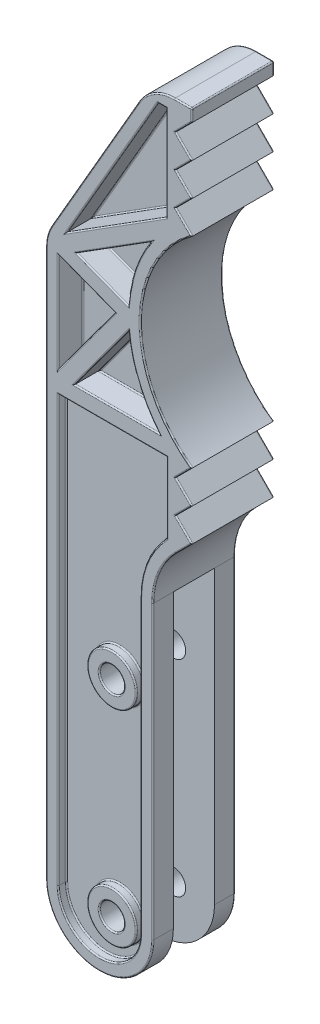
from build123d import *

# Parameters (mm, degrees)
SKETCH_1_R          = 1.5000000000000004
SKETCH_1_R_2        = 1.5000000000000009
EXTRUDE_1_DEPTH     = 5
CUT_EXTRUDE_1_DEPTH = 2.5
CUT_EXTRUDE_2_DEPTH = 1
SKETCH_4_R          = 3.000000000000001
SKETCH_4_R_2        = 1.5000000000000009
SKETCH_4_R_3        = 1.5000000000000007
EXTRUDE_2_DEPTH     = 1
CUT_EXTRUDE_3_DEPTH = 2
EXTRUDE_3_REACH     = 94.277
EXTRUDE_2_2_REACH   = 94.277
EXTRUDE_3_2_DEPTH   = 1
FILLET_8_R          = 5
FILLET_9_R          = 0.15


with BuildPart() as part:
    # 草图1 → 凸台-拉伸1 (new, symmetric)
    with BuildSketch(Plane.XY):
        with BuildLine():
            Line((0, 88.5), (-2, 86.50000000000001))
            Line((-2, 86.50000000000001), (0, 84.5))
            Line((0, 84.5), (-2, 82.5))
            Line((-2, 82.5), (0, 80.5))
            Line((0, 80.5), (-2.0000000000008176, 78.49999999999999))
            Line((-2.0000000000008176, 78.49999999999999), (-7.9661e-13, 76.50000000000001))
            ThreePointArc((-7.9661e-13, 76.50000000000001), (-6.27303030829221, 64.29999999999991), (-5.4253e-13, 52.1))
            Line((-5.4253e-13, 52.1), (-2.000000000000522, 50.099999999999994))
            Line((-2.000000000000522, 50.099999999999994), (0, 48.1))
            Line((0, 48.1), (-1.9999999999999958, 46.09999999999999))
            Line((-1.9999999999999958, 46.09999999999999), (0, 44.1))
            Line((0, 44.1), (-2, 42.1))
            ThreePointArc((-2, 42.1), (-4.035298285696091, 39.05396085688401), (-4.749999999999991, 35.46091270347397))
            Line((-4.749999999999991, 35.46091270347397), (-4.749999999999991, 0))
            ThreePointArc((-4.749999999999991, 0), (-11.249999999999993, -6.499999999999998), (-17.74999999999999, 0))
            Line((-17.74999999999999, 0), (-17.75, 67.91635220349652))
            Line((-17.75, 67.91635220349652), (-5, 90))
            Line((-5, 90), (0, 90))
            Line((0, 90), (0, 88.5))
        make_face()
        with Locations((-9.749999999999991, 0)):
            Circle(SKETCH_1_R, mode=Mode.SUBTRACT)
        with Locations((-9.749999999999991, 25)):
            Circle(SKETCH_1_R_2, mode=Mode.SUBTRACT)
    extrude(amount=EXTRUDE_1_DEPTH, both=True)

    # 草图2 → 切除-拉伸1 (cut, symmetric)
    with BuildSketch(Plane.XY):
        with BuildLine():
            Line((-14.999999999999993, -8.410797367109796), (-14.999999999999993, 23.589202632890206))
            ThreePointArc((-14.999999999999993, 23.589202632890206), (-12.08295106229247, 31.431396203569264), (-4.749999999999999, 35.46091270347397))
            Line((-4.749999999999999, 35.46091270347397), (-4.74999999999999, -8.410797367109796))
            Line((-4.74999999999999, -8.410797367109796), (-14.999999999999993, -8.410797367109796))
        make_face()
    cut_extrude_1 = extrude(amount=CUT_EXTRUDE_1_DEPTH, both=True, mode=Mode.SUBTRACT)

    # 草图3 → 切除-拉伸2 (cut)
    with BuildSketch(Plane.XY.offset(5)):
        with BuildLine():
            Line((-3.1276474698876005, 88.5), (-4.133974596215559, 88.5))
            Line((-4.133974596215559, 88.5), (-16.249999999999996, 67.51442841484983))
            Line((-16.249999999999996, 67.51442841484983), (-16.249999999999986, 0))
            ThreePointArc((-16.249999999999986, 0), (-11.24999999999999, -4.999999999999995), (-6.249999999999993, 7.2e-16))
            Line((-6.249999999999992, 6.1e-16), (-6.249999999999999, 35.46091270347397))
            ThreePointArc((-6.250000000000002, 35.46091270347397), (-5.4211175844630315, 39.62798600543165), (-3.0606601717798148, 43.16066017177982))
            Line((-3.0606601717798156, 43.16066017177982), (-3.0748559707931324, 52.76887208327246))
            ThreePointArc((-3.0748559707931413, 52.768872083272456), (-7.773012299367757, 64.27562185032697), (-3.1088780531322087, 75.79620407617077))
            Line((-3.108878053132212, 75.79620407617077), (-3.1276474698876005, 88.5))
        make_face()
    cut_extrude_2 = extrude(amount=-CUT_EXTRUDE_2_DEPTH, mode=Mode.SUBTRACT)

    # 草图4 → Extrude 2 (add)
    # profile 1 of 2: a face of its own
    with BuildSketch(Plane.XY.offset(4)):
        with Locations((-9.749999999999991, 25)):
            Circle(SKETCH_4_R)
        with Locations((-9.749999999999991, 25)):
            Circle(SKETCH_4_R_2, mode=Mode.SUBTRACT)
    # profile 2 of 2: a face of its own
    with BuildSketch(Plane.XY.offset(4)):
        with Locations((-9.749999999999991, 0)):
            Circle(SKETCH_4_R)
        with Locations((-9.749999999999991, 0)):
            Circle(SKETCH_4_R_3, mode=Mode.SUBTRACT)
    extrude_2 = extrude(amount=EXTRUDE_2_DEPTH)

    # 草图5 → 切除-拉伸3 (cut)
    with BuildSketch(Plane.XY.offset(4)):
        with BuildLine():
            Line((-16.249999999999996, 52.76887208327247), (-3.07485597079314, 52.76887208327247))
            ThreePointArc((-3.0748559707931413, 52.76887208327247), (-7.77301229936776, 64.27562185032698), (-3.1088780531322158, 75.79620407617077))
            Line((-3.1088780531322144, 75.79620407617077), (-3.1276474698876005, 88.5))
            Line((-3.1276474698876005, 88.5), (-4.133974596215559, 88.5))
            Line((-4.133974596215559, 88.5), (-16.25, 67.51442841484983))
            Line((-16.25, 67.51442841484983), (-16.249999999999996, 52.76887208327247))
        make_face()
    cut_extrude_3 = extrude(amount=-CUT_EXTRUDE_3_DEPTH, mode=Mode.SUBTRACT)

    # 草图6 → Extrude 3 (add, up to next)
    with BuildSketch(Plane.XY.offset(5), mode=Mode.PRIVATE) as extrude_3_sk1:
        Polygon((-3.0748559707931356, 53.76887208327247), (-14.27123925145504, 53.76887208327248), (-6.188347610025472, 64.74067183062967), (-14.024819557731465, 67.73475624873448), (-2.575708187780833, 74.95019586422413), (-3.642047918483592, 76.64221228811746), (-18.475180442268538, 67.29410058096518), (-9.357676988710054, 63.81057187002435), (-18.228760748544946, 51.76887208327248), (-3.0748559707931364, 51.76887208327247), align=None)
    extrude_3_tool1 = extrude(extrude_3_sk1.sketch, amount=-EXTRUDE_3_REACH, mode=Mode.PRIVATE) - part.part
    extrude_3 = extrude_3_tool1.solids().sort_by_distance((-8.673048, 53.473664, 5))[0]
    add(extrude_3)

    # 草图7 → Extrude 2 2 (add, up to next)
    with BuildSketch(Plane.XY.offset(5), mode=Mode.PRIVATE) as extrude_2_2_sk1:
        Polygon((-3.6420479184835903, 76.64221228811746), (-3.1088780531322016, 75.79620407617078), (-3.110622824379444, 76.9771261126723), align=None)
    extrude_2_2_tool1 = extrude(extrude_2_2_sk1.sketch, amount=-EXTRUDE_2_2_REACH, mode=Mode.PRIVATE) - part.part
    extrude_2_2 = extrude_2_2_tool1.solids().sort_by_distance((-3.287183, 76.471847, 5))[0]
    add(extrude_2_2)

    # 草图8 → Extrude 3 2 (add)
    with BuildSketch(Plane.XY.offset(5)):
        Polygon((-3.074855970798324, 52.76887209029672), (-3.0748559707931364, 51.76887208327246), (-3.0733785055593463, 51.76887208327246), align=None)
    extrude_3_2 = extrude(amount=-EXTRUDE_3_2_DEPTH)

    # 镜向1: 切除-拉伸1, 切除-拉伸2, Extrude 2, 切除-拉伸3, Extrude 3, Extrude 2 2, Extrude 3 2 across plane
    add(cut_extrude_1.mirror(Plane.XY), mode=Mode.SUBTRACT)
    add(cut_extrude_2.mirror(Plane.XY), mode=Mode.SUBTRACT)
    add(extrude_2.mirror(Plane.XY))
    add(cut_extrude_3.mirror(Plane.XY), mode=Mode.SUBTRACT)
    add(extrude_3.mirror(Plane.XY))
    add(extrude_2_2.mirror(Plane.XY))
    add(extrude_3_2.mirror(Plane.XY))

    # 圆角8
    fillet_8_edges = [part.edges().sort_by_distance(p)[0] for p in [
        (-17.75, 67.91635220349652, 0),
        (-5, 90, 0),
    ]]
    fillet(fillet_8_edges, radius=FILLET_8_R)

    # 圆角9
    fillet_9_edges = [part.edges().sort_by_distance(p)[0] for p in [
        (-12.749999999999993, 25, 5),
        (-12.749999999999993, 25, 4),
        (-11.249999999999993, 25, 5),
        (-12.749999999999993, -9.6e-16, 5),
        (-12.749999999999993, -9.6e-16, 4),
        (-11.249999999999991, 1.8e-16, 5),
        (-9.655598316294748, 78.93626717654524, 2),
        (-3.6308110330515797, 88.5, 2),
        (-6.503724820190058, 57.95366683152835, 2),
        (-6.917749026117381, 69.5433554371347, 2),
        (-16.25, 60.44939351261104, 2),
        (-16.249999999999996, 60.449393512611046, 5),
        (-16.24999999999999, 25.884436041636235, 5),
        (-16.24999999999999, 25.884436041636235, 4),
        (-6.917749026117226, 69.54335543713512, 5),
        (-6.503724820189971, 57.95366683152813, 5),
        (-9.531237420300998, 70.56669398802231, 2),
        (-10.882717588057453, 66.53425191332991, 2),
        (-10.983046723277745, 58.23229823697713, 2),
        (-9.12322415102722, 53.76887208327247, 2),
        (-9.66168925277967, 51.76887208327247, 4),
        (-11.24999999999999, -6.499999999999998, 5),
        (-9.66168925277967, 51.76887208327247, 5),
        (-12.803838494355027, 59.13271701135148, 2),
        (-12.803838494355023, 59.13271701135149, 5),
        (-12.803838494355027, 65.12724837128391, 1.9999999999999996),
        (-12.803838494355023, 65.12724837128391, 5),
        (-9.143922430376692, 73.17483023288138, 5),
        (-9.143922430376692, 73.17483023288139, 2),
        (-9.123224151027086, 53.76887208327248, 5),
        (-10.983046723277788, 58.23229823697707, 5),
        (-10.882717588057421, 66.5342519133299, 5),
        (-9.531237420300554, 70.56669398802258, 5),
        (0, 89.25, -5),
        (-1, 87.5, -5),
        (-1, 85.5, -5),
        (-1, 83.5, -5),
        (-1, 81.5, -5),
        (-3.119135147133528, 82.73856305633615, 2),
        (-1.0000000000004088, 79.5, -5),
        (-1.0000000000008071, 77.5, -5),
        (-4.749999999999991, 17.730456351736986, 5),
        (-6.273030308292213, 64.29999999999994, -5),
        (-1.000000000000532, 51.099999999999994, -5),
        (-3.0670193386719102, 47.46476612752613, 5),
        (-3.0670193386719102, 47.46476612752613, 4),
        (-1.000000000000261, 49.099999999999994, -5),
        (-0.9999999999999979, 47.099999999999994, -5),
        (-0.9999999999999979, 45.099999999999994, -5),
        (-1, 43.1, -5),
        (-4.03529828569609, 39.05396085688401, -5),
        (-4.749999999999991, 17.730456351736986, -5),
        (-11.24999999999999, -6.499999999999998, -5),
        (-4.03529828569609, 39.05396085688401, 5),
        (-3.6308110330515797, 88.5, -5),
        (-9.655598316294752, 78.93626717654523, -5),
        (-11.24999999999999, -4.999999999999995, -5),
        (-6.249999999999996, 17.730456351736986, -5),
        (-5.421117584463032, 39.62798600543165, -4),
        (-11.24999999999999, -4.999999999999995, -4),
        (-6.249999999999996, 17.730456351736986, -4),
        (-5.421117584463032, 39.62798600543165, -5),
        (-1.0566243270259283, 90, -5),
        (-3.119135147133527, 82.73856305633615, -5),
        (-12.749999999999993, 25, -4),
        (-12.749999999999993, 25, -5),
        (-11.249999999999993, 25, -5),
        (-12.749999999999993, -9.6e-16, -4),
        (-12.749999999999993, -9.6e-16, -5),
        (-11.249999999999991, 1.8e-16, -5),
        (-3.6308110330515797, 88.5, -2),
        (-9.655598316294748, 78.93626717654524, -2),
        (-1, 43.1, 5),
        (-16.25, 60.44939351261104, -2),
        (-6.503724820190058, 57.95366683152835, -2),
        (-6.917749026117381, 69.5433554371347, -2),
        (-16.24999999999999, 25.884436041636235, -4),
        (-16.249999999999996, 60.449393512611046, -5),
        (-16.24999999999999, 25.884436041636235, -5),
        (0, 90, 0),
        (-6.917749026117226, 69.54335543713512, -5),
        (-6.503724820189971, 57.95366683152813, -5),
        (-9.143922430376692, 73.17483023288138, -2),
        (-12.803838494355027, 65.12724837128391, -1.9999999999999996),
        (-12.803838494355027, 59.13271701135148, -2),
        (-9.66168925277967, 51.76887208327247, -4),
        (-9.12322415102722, 53.76887208327247, -2),
        (-9.123224151027086, 53.76887208327248, -5),
        (-10.983046723277745, 58.23229823697713, -2),
        (-10.983046723277788, 58.23229823697707, -5),
        (-10.882717588057453, 66.53425191332991, -2),
        (-10.882717588057423, 66.5342519133299, -5),
        (-9.531237420300998, 70.56669398802231, -2),
        (-0.9999999999999979, 45.099999999999994, 5),
        (-9.531237420300554, 70.56669398802258, -5),
        (-9.66168925277967, 51.76887208327247, -5),
        (-12.803838494355023, 59.13271701135149, -5),
        (-12.803838494355023, 65.12724837128391, -5),
        (-9.143922430376692, 73.17483023288138, -5),
        (-3.119135147133528, 82.73856305633615, -2),
        (-3.0670193386719102, 47.46476612752614, -4),
        (-0.9999999999999979, 47.099999999999994, 5),
        (-3.0670193386719102, 47.46476612752614, -5),
        (-11.761751345948142, 78.28830312067042, -5),
        (-11.761751345948142, 78.28830312067042, 5),
        (-17.749999999999993, 33.28830312067045, -5),
        (-17.579629131445344, 67.87070146685349, -5),
        (-4.613248654051869, 89.33012701892218, -5),
        (-17.749999999999993, 33.28830312067045, 5),
        (-17.579629131445344, 67.87070146685349, 5),
        (-4.613248654051869, 89.33012701892218, 5),
        (-1.000000000000261, 49.099999999999994, 5),
        (-1.000000000000532, 51.099999999999994, 5),
        (-6.273030308292213, 64.29999999999994, 5),
        (-1.0566243270259283, 90, 5),
        (-1.0000000000008071, 77.5, 5),
        (-1.0000000000004088, 79.5, 5),
        (-1, 81.5, 5),
        (-1, 83.5, 5),
        (-1, 85.5, 5),
        (-1, 87.5, 5),
        (0, 89.25, 5),
        (-5.421117584463032, 39.62798600543165, 5),
        (-6.249999999999996, 17.730456351736986, 4),
        (-11.24999999999999, -4.999999999999995, 4),
        (-3.119135147133527, 82.73856305633615, 5),
        (-5.421117584463032, 39.62798600543165, 4),
        (-3.6308110330515797, 88.5, 5),
        (-9.655598316294752, 78.93626717654523, 5),
        (-11.24999999999999, -4.999999999999995, 5),
        (-6.249999999999996, 17.730456351736986, 5),
    ]]
    fillet(fillet_9_edges, radius=FILLET_9_R)


solid = part.part
